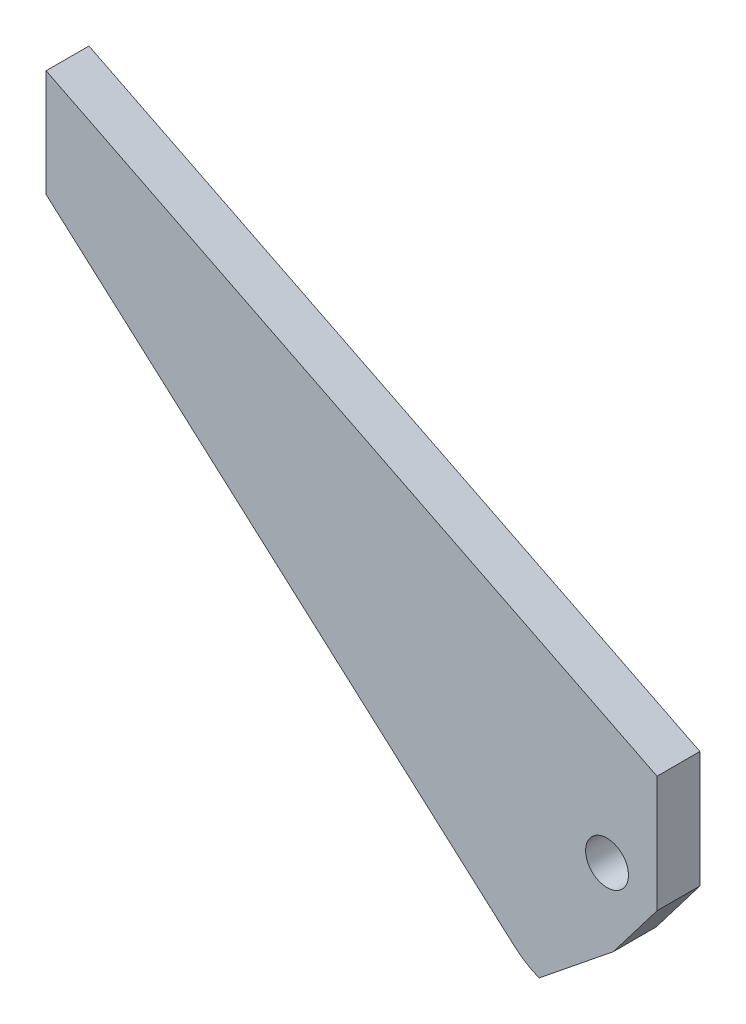
from build123d import *

# Parameters (mm, degrees)
SKETCH1_R           = 1.5
BOSS_EXTRUDE1_DEPTH = 3
CUT_EXTRUDE1_DEPTH  = 3


with BuildPart() as part:
    # Sketch1 → Boss-Extrude1 (new body)
    with BuildSketch(Plane.XY):
        with BuildLine():
            Line((2, 15), (2, 4.201633911))
            ThreePointArc((2, 4.201633911), (-1.543579693, -1.272486957), (-7.988666425, -0.280613309))
            Line((-7.988666425, -0.280613309), (-16.754941475, 7.52032788))
            Line((-16.754941475, 7.52032788), (-40.754941475, 28.877470737))
            Line((-40.754941475, 28.877470737), (-40.754941475, 36.377470737))
            Line((-40.754941475, 36.377470737), (2, 15))
        make_face()
        with Locations((-1.5, 8)):
            Circle(SKETCH1_R, mode=Mode.SUBTRACT)
    extrude(amount=BOSS_EXTRUDE1_DEPTH)

    # Sketch2 → Cut-Extrude1 (cut)
    with BuildSketch(Plane.XY.offset(3)):
        Polygon((-1.061667456, 2.832415464), (-6.529971665, -1.578677992), (-7.079129118, -3.627506614), (6.602158547, -3.973243126), (4.478348548, 4.339015555), (2, 6.845428543), align=None)
    extrude(amount=-CUT_EXTRUDE1_DEPTH, mode=Mode.SUBTRACT)


solid = part.part
